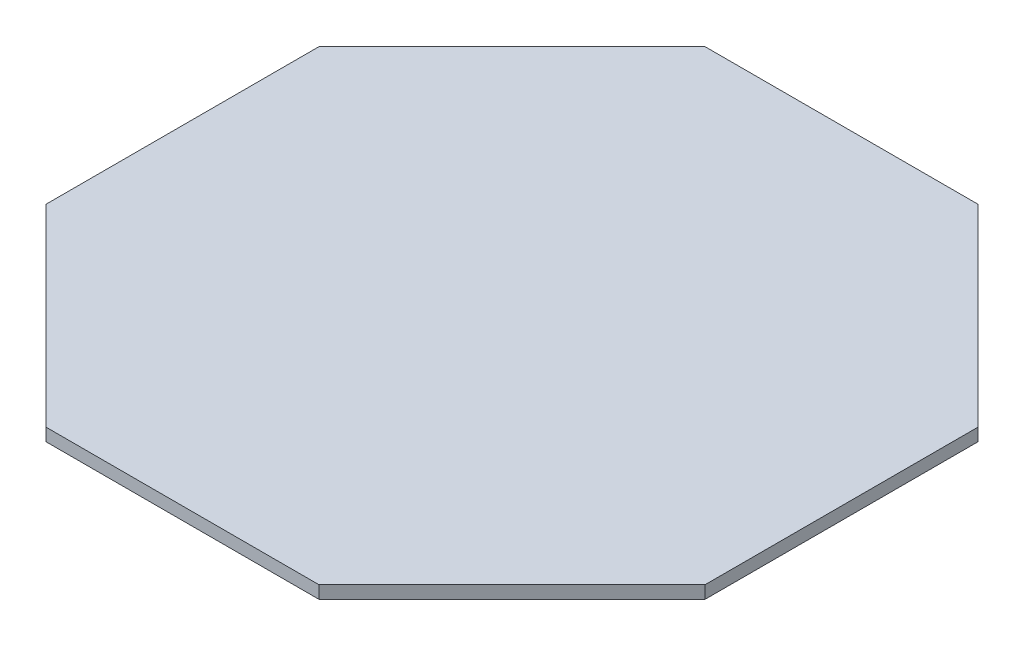
from build123d import *

# Parameters (mm, degrees)
BOSS_EXTRUDE5_DEPTH = 3


with BuildPart() as part:
    # Sketch6 → Boss-Extrude5 (new body)
    with BuildSketch(Plane(origin=(0, 0, 0), x_dir=(1, 0, 0), z_dir=(0, 1, 0))):
        Polygon((78, 32.308657865), (32.308657865, 78), (-32.308657865, 78), (-78, 32.308657865), (-78, -32.308657865), (-32.308657865, -78), (32.308657865, -78), (78, -32.308657865), align=None)
    extrude(amount=-BOSS_EXTRUDE5_DEPTH)


solid = part.part
